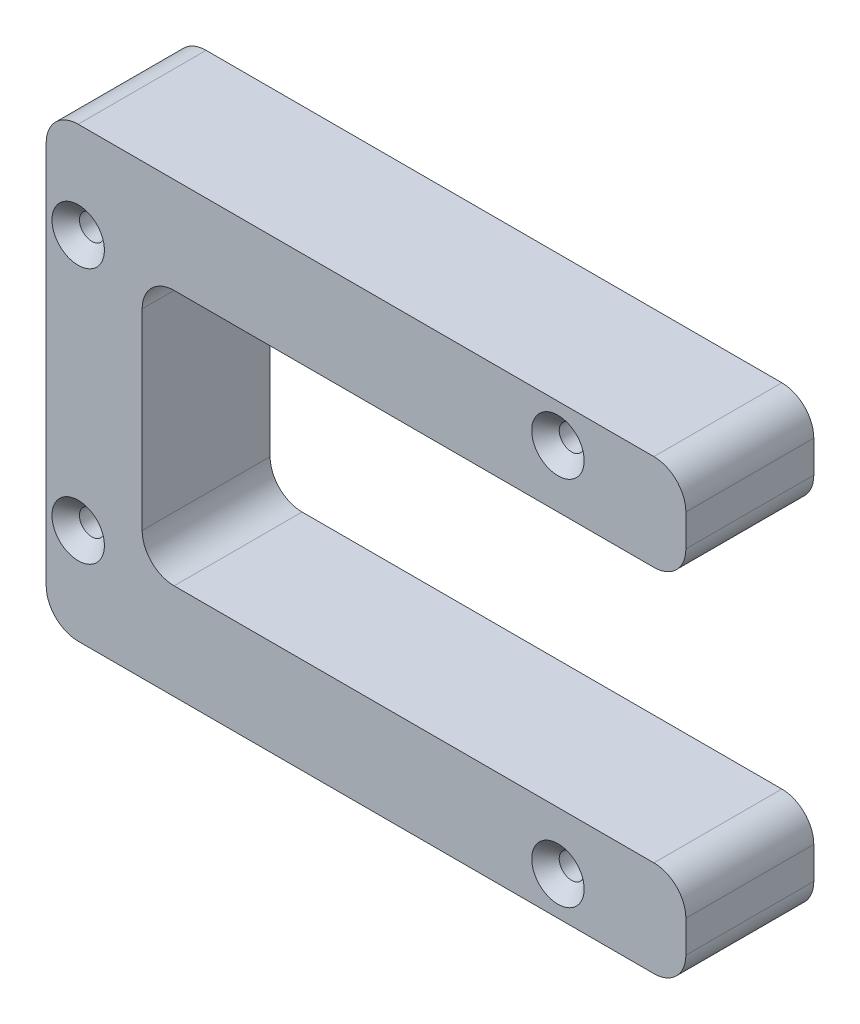
from build123d import *

# Parameters (mm, degrees)
SCHIZZO1_W                               = 70
SCHIZZO1_H                               = 100
ESTRUSIONE_ESTRUSIONE1_DEPTH             = 20
FORO_SVASATO_PER_VITE_M3_5_2_D           = 3.9
FORO_SVASATO_PER_VITE_M3_5_2_CSINK_D     = 8.2
FORO_SVASATO_PER_VITE_M3_5_2_CSINK_ANGLE = 90
SCHIZZO8_W                               = 85
SCHIZZO8_H                               = 40
TAGLIO_ESTRUSIONE1_DEPTH                 = 65.226162893
RACCORDO2_R                              = 5


with BuildPart() as part:
    # Schizzo1 → Estrusione-Estrusione1 (new body)
    with BuildSketch(Plane(origin=(0, 0, 0), x_dir=(0, 1, 0), z_dir=(0, 0, 1))):
        Rectangle(SCHIZZO1_W, SCHIZZO1_H)
    extrude(amount=ESTRUSIONE_ESTRUSIONE1_DEPTH)

    # Foro svasato per Vite M3.5-2 (through all)
    with Locations(Plane.XY.offset(20)):
        with Locations((-45, -20), (30, -29)):
            foro_svasato_per_vite_m3_5_2 = CounterSinkHole(FORO_SVASATO_PER_VITE_M3_5_2_D / 2, FORO_SVASATO_PER_VITE_M3_5_2_CSINK_D / 2, counter_sink_angle=FORO_SVASATO_PER_VITE_M3_5_2_CSINK_ANGLE)

    # Specchia1: Foro svasato per Vite M3.5-2 across plane
    add(foro_svasato_per_vite_m3_5_2.mirror(Plane.ZX), mode=Mode.SUBTRACT)

    # Schizzo8 → Taglio-Estrusione1 (cut, through all)
    with BuildSketch(Plane.XY.offset(20)):
        with Locations((7.5, 0)):
            Rectangle(SCHIZZO8_W, SCHIZZO8_H)
    extrude(amount=-TAGLIO_ESTRUSIONE1_DEPTH, mode=Mode.SUBTRACT)

    # Raccordo2
    raccordo2_edges = [part.edges().sort_by_distance(p)[0] for p in [
        (50, 20, 10),
        (50, -20, 10),
        (-35, -20, 10),
        (-35, 20, 10),
        (50, 35, 10),
        (50, -35, 10),
        (-50, -35, 10),
        (-50, 35, 10),
    ]]
    fillet(raccordo2_edges, radius=RACCORDO2_R)


solid = part.part
